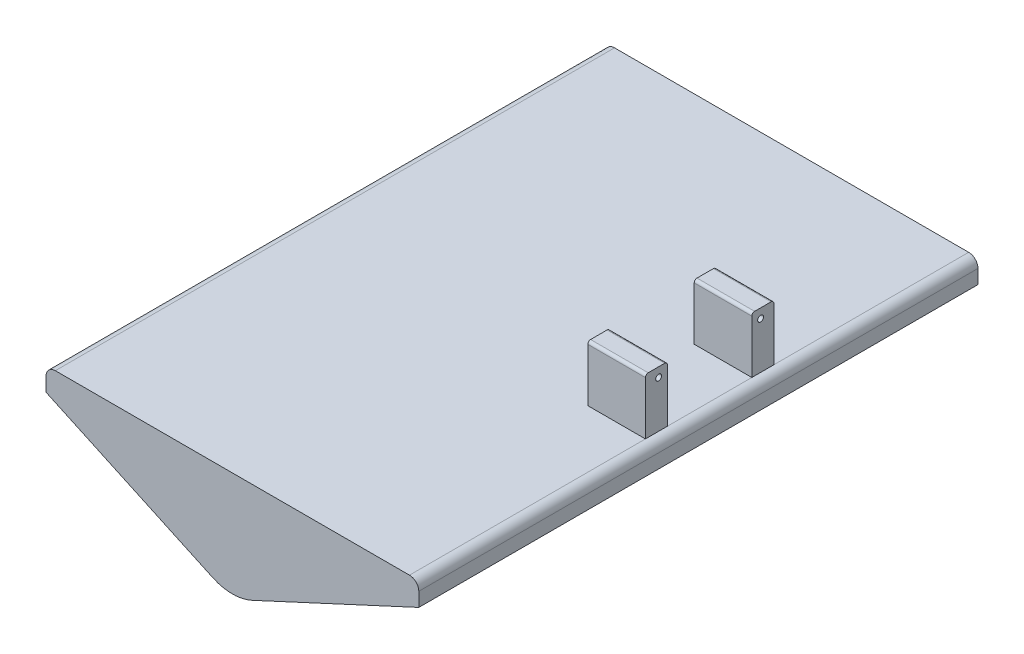
from build123d import *

# Parameters (mm, degrees)
SKETCH2_W               = 101.6
SKETCH2_H               = 6.35
BOSS_EXTRUDE1_DEPTH     = 152.4
CUT_EXTRUDE1_START      = -6.35
SKETCH3_R               = 6.985
CUT_EXTRUDE1_DEPTH      = 157.289355631
CUT_EXTRUDE2_START      = -6.35
SKETCH4_W               = 101.6
SKETCH4_H               = 38.1
CUT_EXTRUDE2_DEPTH      = 157.815347501
FILLET4_R               = 2.54
SKETCH5_W               = 15.7
SKETCH5_H               = 6
BOSS_EXTRUDE2_DEPTH     = 15.24
SKETCH6_R               = 0.8
CUT_EXTRUDE4_DEPTH      = 176.555716512
FILLET7_R               = 0.762
FILLET8_R               = 0.762
TAP_DRILL_FOR_M2_TAP3_D = 1.6


with BuildPart() as part:
    # Sketch2 → Boss-Extrude1 (new body)
    with BuildSketch(Plane.XY):
        with BuildLine():
            Line((-50.8, -3.175), (-5.335878714, -24.224686475))
            ThreePointArc((-5.335878714, -24.224686475), (0, -25.4), (5.335878714, -24.224686475))
            Line((5.335878714, -24.224686475), (50.8, -3.175))
            Line((50.8, -3.175), (-50.8, -3.175))
        make_face()
        Rectangle(SKETCH2_W, SKETCH2_H)
    extrude(amount=BOSS_EXTRUDE1_DEPTH)

    # Sketch3 → Cut-Extrude1 (cut, through all)
    with BuildSketch(Plane.XY.offset(152.4).offset(CUT_EXTRUDE1_START)):
        with Locations((0, -12.7)):
            Circle(SKETCH3_R)
    extrude(amount=-CUT_EXTRUDE1_DEPTH, mode=Mode.SUBTRACT)

    # Sketch4 → Cut-Extrude2 (cut, through all)
    with BuildSketch(Plane(origin=(0, 3.175, 0), x_dir=(1, 0, 0), z_dir=(0, 1, 0)).offset(CUT_EXTRUDE2_START)):
        with Locations((0, -76.2)):
            Rectangle(SKETCH4_W, SKETCH4_H)
    extrude(amount=-CUT_EXTRUDE2_DEPTH, mode=Mode.SUBTRACT)

    # Fillet4
    fillet4_edges = [part.edges().sort_by_distance(p)[0] for p in [
        (-50.8, 3.175, 76.2),
        (50.8, 3.175, 76.2),
    ]]
    fillet(fillet4_edges, radius=FILLET4_R)

    # Sketch5 → Boss-Extrude2 (add)
    with BuildSketch(Plane(origin=(0, 3.175, 0), x_dir=(1, 0, 0), z_dir=(0, 1, 0))):
        with Locations((40.41, -85.1)):
            Rectangle(SKETCH5_W, SKETCH5_H)
        with Locations((40.41, -56.1)):
            Rectangle(SKETCH5_W, SKETCH5_H)
    extrude(amount=BOSS_EXTRUDE2_DEPTH)

    # Sketch6 → Cut-Extrude4 (cut, through all)
    with BuildSketch(Plane.ZY.offset(-32.56)):
        with Locations((84.495000084, 15.875)):
            Circle(SKETCH6_R)
        with Locations((56.704999916, 15.875)):
            Circle(SKETCH6_R)
    extrude(amount=-CUT_EXTRUDE4_DEPTH, mode=Mode.SUBTRACT)

    # Fillet7
    fillet7_edges = [part.edges().sort_by_distance(p)[0] for p in [
        (40.41, 18.415, 82.1),
        (40.41, 18.415, 88.1),
    ]]
    fillet(fillet7_edges, radius=FILLET7_R)

    # Fillet8
    fillet8_edges = [part.edges().sort_by_distance(p)[0] for p in [
        (40.41, 18.415, 53.1),
        (40.41, 18.415, 59.1),
    ]]
    fillet(fillet8_edges, radius=FILLET8_R)

    # Tap Drill for M2 Tap3 (through all)
    with Locations(Plane.ZY.offset(-32.56)):
        with Locations((84.495000084, 15.875), (56.704999916, 15.875)):
            Hole(TAP_DRILL_FOR_M2_TAP3_D / 2)


solid = part.part
